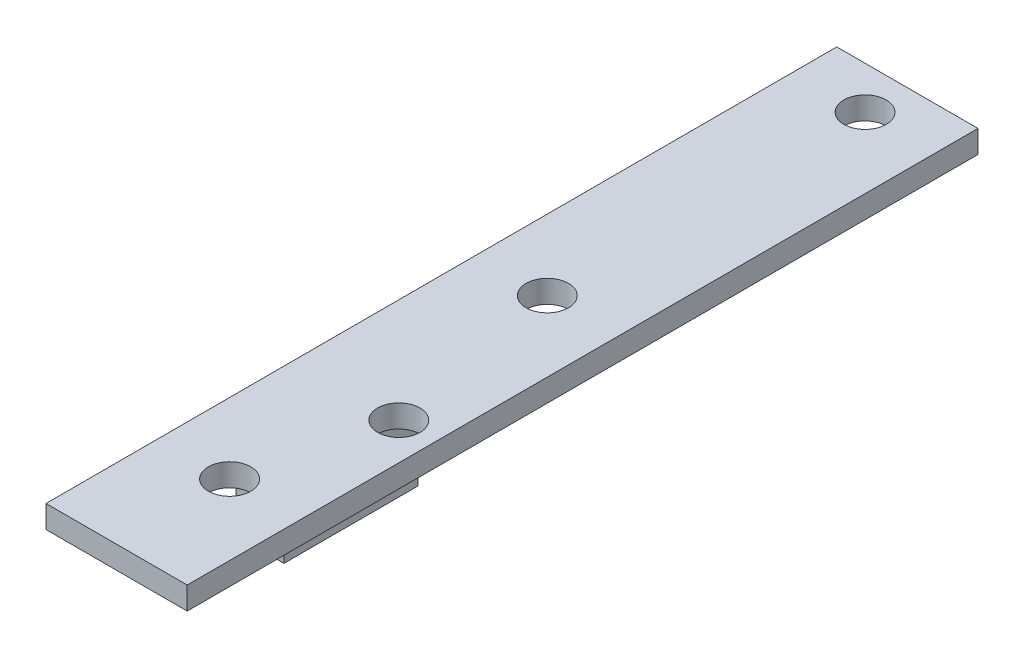
from build123d import *

# Parameters (mm, degrees)
SKETCH_1_W      = 10
SKETCH_1_H      = 56
SKETCH_1_R      = 1.5
EXTRUDE_1_DEPTH = 1.6
SKETCH_2_W      = 3.4
SKETCH_2_H      = 9.5
EXTRUDE_2_DEPTH = 6.5


with BuildPart() as part:
    # 草图1 → 凸台-拉伸1 (new body)
    with BuildSketch(Plane(origin=(0, 0, 0), x_dir=(1, 0, 0), z_dir=(0, 1, 0))):
        Rectangle(SKETCH_1_W, SKETCH_1_H)
        with Locations(Location((2.385, -10.4, 0), (0, 0, 270))):
            Circle(SKETCH_1_R, mode=Mode.SUBTRACT)
        with Locations(Location((0, 25, 0), (0, 0, 270))):
            Circle(SKETCH_1_R, mode=Mode.SUBTRACT)
        with Locations(Location((0, 2.5, 0), (0, 0, 270))):
            Circle(SKETCH_1_R, mode=Mode.SUBTRACT)
        with Locations(Location((0, -20, 0), (0, 0, 270))):
            Circle(SKETCH_1_R, mode=Mode.SUBTRACT)
    extrude(amount=EXTRUDE_1_DEPTH)

    # 草图2 → 凸台-拉伸2 (add)
    with BuildSketch(Plane.XZ):
        with Locations((-2.7, 10.4)):
            Rectangle(SKETCH_2_W, SKETCH_2_H)
    extrude(amount=EXTRUDE_2_DEPTH)


solid = part.part
